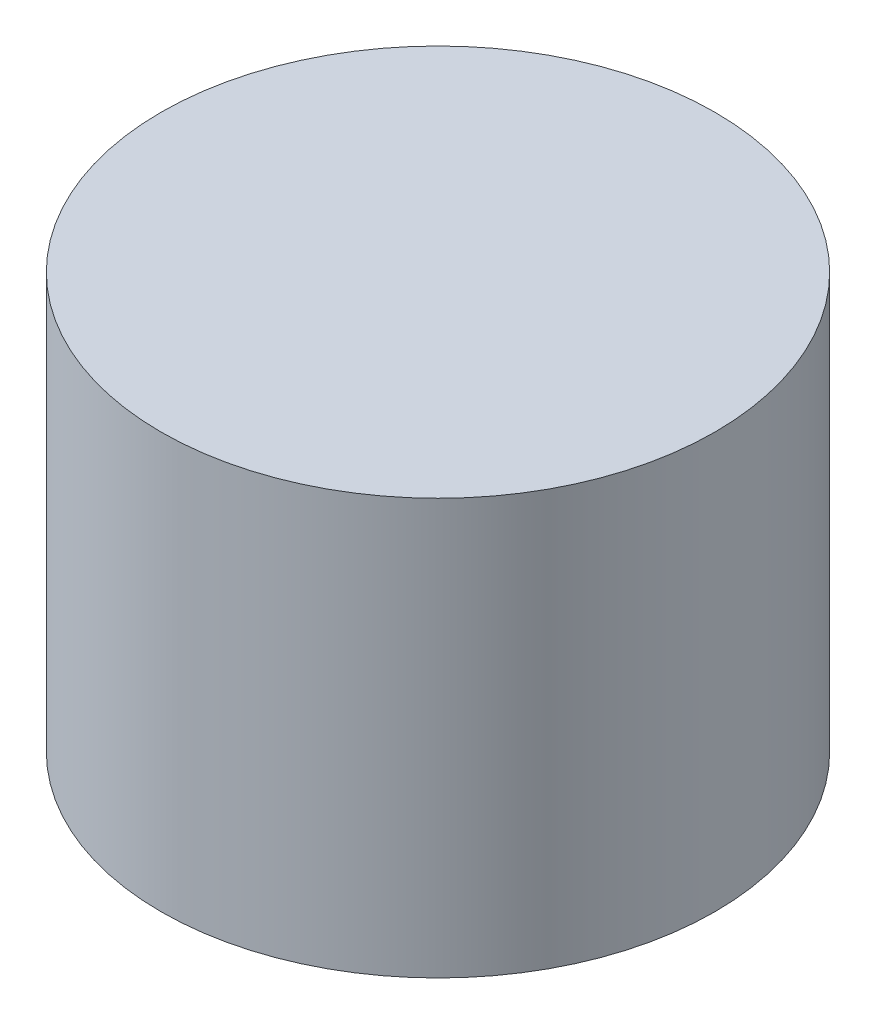
from build123d import *

# Parameters (mm, degrees)
SKETCH1_R           = 50.8
BOSS_EXTRUDE1_DEPTH = 76.2


with BuildPart() as part:
    # Sketch1 → Boss-Extrude1 (new body)
    with BuildSketch(Plane(origin=(0, 0, 0), x_dir=(1, 0, 0), z_dir=(0, 1, 0))):
        with Locations(Location((0, 0, 0), (0, 0, 90))):
            Circle(SKETCH1_R)
    extrude(amount=BOSS_EXTRUDE1_DEPTH)


solid = part.part
